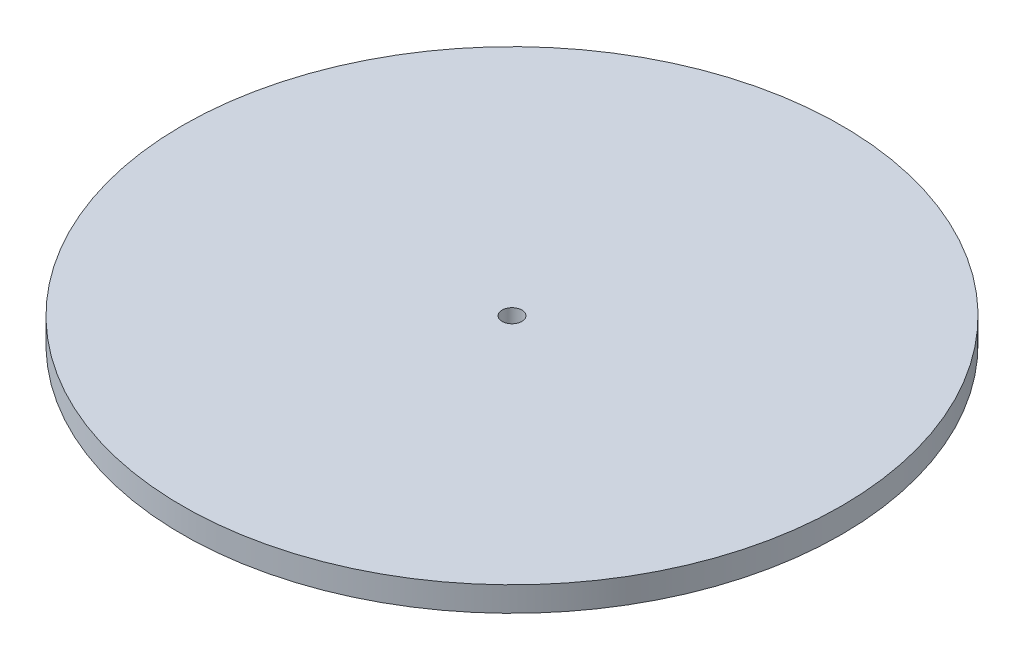
from build123d import *

# Parameters (mm, degrees)
SKETCH5_R          = 1.2
CUT_EXTRUDE1_DEPTH = 59.064349905


with BuildPart() as part:
    # Sketch3 → Revolve4 (revolve)
    with BuildSketch(Plane.XY, mode=Mode.PRIVATE) as revolve4_sk:
        with BuildLine():
            Line((1.2, 13.094606802), (1.2, 8.094606802))
            Line((1.2, 8.094606802), (0, 8.094606802))
            Line((0, 8.094606802), (0, 0))
            add(Edge.make_bspline(
                [(0, 0), (4.625, 0.001359631), (9.25, 0.613543178), (13.875, 1.903514856), (18.5, 3.227503621), (23.125, 4.699723597), (27.75, 6.165361426), (32.375, 7.639151601), (37, 9.094606802)],
                knots=[0.083434197, 0.083434197, 0.083434197, 0.083434197, 0.083434197, 0.083434197, 0.083434197, 0.083434197, 0.083434197, 0.917776165, 0.917776165, 0.917776165, 0.917776165, 0.917776165, 0.917776165, 0.917776165, 0.917776165, 0.917776165], degree=8))
            Line((37, 9.094606802), (37, 10.094606802))
            Line((37, 10.094606802), (40, 10.094606802))
            Line((40, 10.094606802), (40, 13.094606802))
            Line((40, 13.094606802), (1.2, 13.094606802))
        make_face()
    revolve(revolve4_sk.sketch.rotate(Axis((0, 13.094606802, 0), (0, -1, 0)), 180), axis=Axis((0, 13.094606802, 0), (0, -1, 0)))

    # Sketch5 → Cut-Extrude1 (cut, through all)
    with BuildSketch(Plane(origin=(0, 13.094606802, 0), x_dir=(1, 0, 0), z_dir=(0, 1, 0))):
        with Locations(Location((0, 0, 0), (0, 0, 180))):
            Circle(SKETCH5_R)
    extrude(amount=-CUT_EXTRUDE1_DEPTH, mode=Mode.SUBTRACT)


solid = part.part
